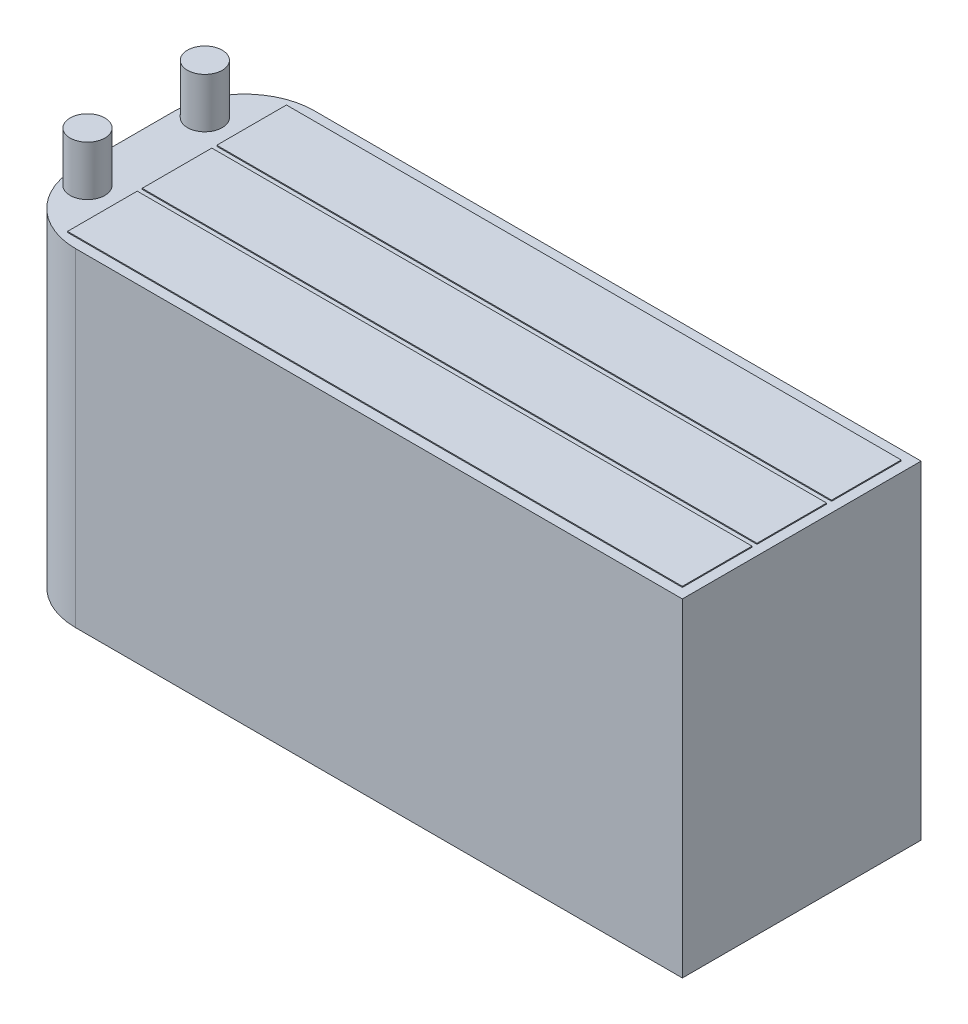
from build123d import *

# Parameters (mm, degrees)
SKETCH1_W             = 68
SKETCH1_H             = 33
BOSS_EXTRUDE1_DEPTH   = 24
FILLET1_R             = 7
SKETCH2_W             = 61.8
SKETCH2_H             = 7
BOSS_EXTRUDE2_DEPTH   = 0.1
BOSS_EXTRUDE2_2_DEPTH = 0.1
BOSS_EXTRUDE2_3_DEPTH = 0.1
SKETCH3_R             = 1.75
BOSS_EXTRUDE3_DEPTH   = 5


with BuildPart() as part:
    # Sketch1 → Boss-Extrude1 (new body)
    with BuildSketch(Plane.XY):
        Rectangle(SKETCH1_W, SKETCH1_H)
    extrude(amount=BOSS_EXTRUDE1_DEPTH)

    # Fillet1
    fillet1_edges = [part.edges().sort_by_distance(p)[0] for p in [
        (-34, 0, 24),
        (-34, 0, 0),
    ]]
    fillet(fillet1_edges, radius=FILLET1_R)

    # Sketch3 → Boss-Extrude3 (add)
    with BuildSketch(Plane(origin=(0, 16.5, 0), x_dir=(1, 0, 0), z_dir=(0, 1, 0))):
        with Locations(Location((-31.9, -6.1, 0), (0, 0, 90))):
            Circle(SKETCH3_R)
        with Locations(Location((-31.9, -17.9, 0), (0, 0, 90))):
            Circle(SKETCH3_R)
    extrude(amount=BOSS_EXTRUDE3_DEPTH)


with BuildPart() as body_2:
    # Sketch2 → Boss-Extrude2 (new body)
    with BuildSketch(Plane(origin=(0, 16.5, 0), x_dir=(1, 0, 0), z_dir=(0, 1, 0))):
        with Locations((2.1, -4.5)):
            Rectangle(SKETCH2_W, SKETCH2_H)
    extrude(amount=BOSS_EXTRUDE2_DEPTH)


with BuildPart() as body_3:
    # Sketch2 → Boss-Extrude2 2 (new body)
    with BuildSketch(Plane(origin=(0, 16.5, 0), x_dir=(1, 0, 0), z_dir=(0, 1, 0))):
        with Locations((2.1, -12)):
            Rectangle(SKETCH2_W, SKETCH2_H)
    extrude(amount=BOSS_EXTRUDE2_2_DEPTH)


with BuildPart() as body_4:
    # Sketch2 → Boss-Extrude2 3 (new body)
    with BuildSketch(Plane(origin=(0, 16.5, 0), x_dir=(1, 0, 0), z_dir=(0, 1, 0))):
        with Locations((2.1, -19.5)):
            Rectangle(SKETCH2_W, SKETCH2_H)
    extrude(amount=BOSS_EXTRUDE2_3_DEPTH)


with BuildPart() as body_5:
    # Mirror1: mirrored copy
    add(body_4.part.mirror(Plane.ZX))


with BuildPart() as body_6:
    # Mirror1 2: mirrored copy
    add(body_3.part.mirror(Plane.ZX))


with BuildPart() as body_7:
    # Mirror1 3: mirrored copy
    add(body_2.part.mirror(Plane.ZX))


solid = Compound([part.part, body_2.part, body_3.part, body_4.part, body_5.part, body_6.part, body_7.part])
